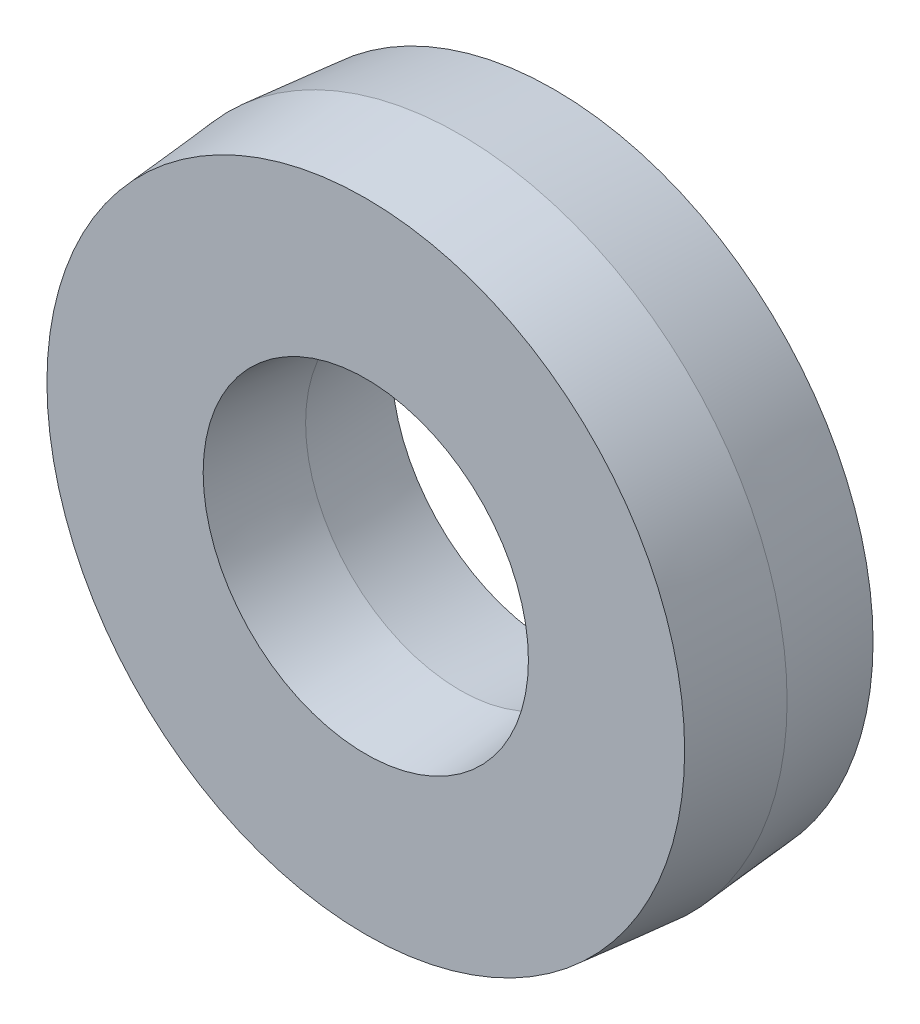
from build123d import *

# Parameters (mm, degrees)
SKETCH1_R                     = 62.5
SKETCH1_R_2                   = 29.5
BOSS_EXTRUDE1_DEPTH           = 18
BOSS_EXTRUDE1_TAPER           = 5
BOSS_EXTRUDE1_OTHER_WAY_DEPTH = 18
BOSS_EXTRUDE1_OTHER_WAY_TAPER = 5


with BuildPart() as part:
    # Sketch1 → Boss-Extrude1 (new body)
    with BuildSketch(Plane.XY):
        Circle(SKETCH1_R)
        Circle(SKETCH1_R_2, mode=Mode.SUBTRACT)
    extrude(amount=BOSS_EXTRUDE1_DEPTH, taper=BOSS_EXTRUDE1_TAPER)

    # Sketch1 → Boss-Extrude1 other way (add)
    with BuildSketch(Plane.XY):
        Circle(SKETCH1_R)
        Circle(SKETCH1_R_2, mode=Mode.SUBTRACT)
    extrude(amount=-BOSS_EXTRUDE1_OTHER_WAY_DEPTH, taper=BOSS_EXTRUDE1_OTHER_WAY_TAPER)


solid = part.part
